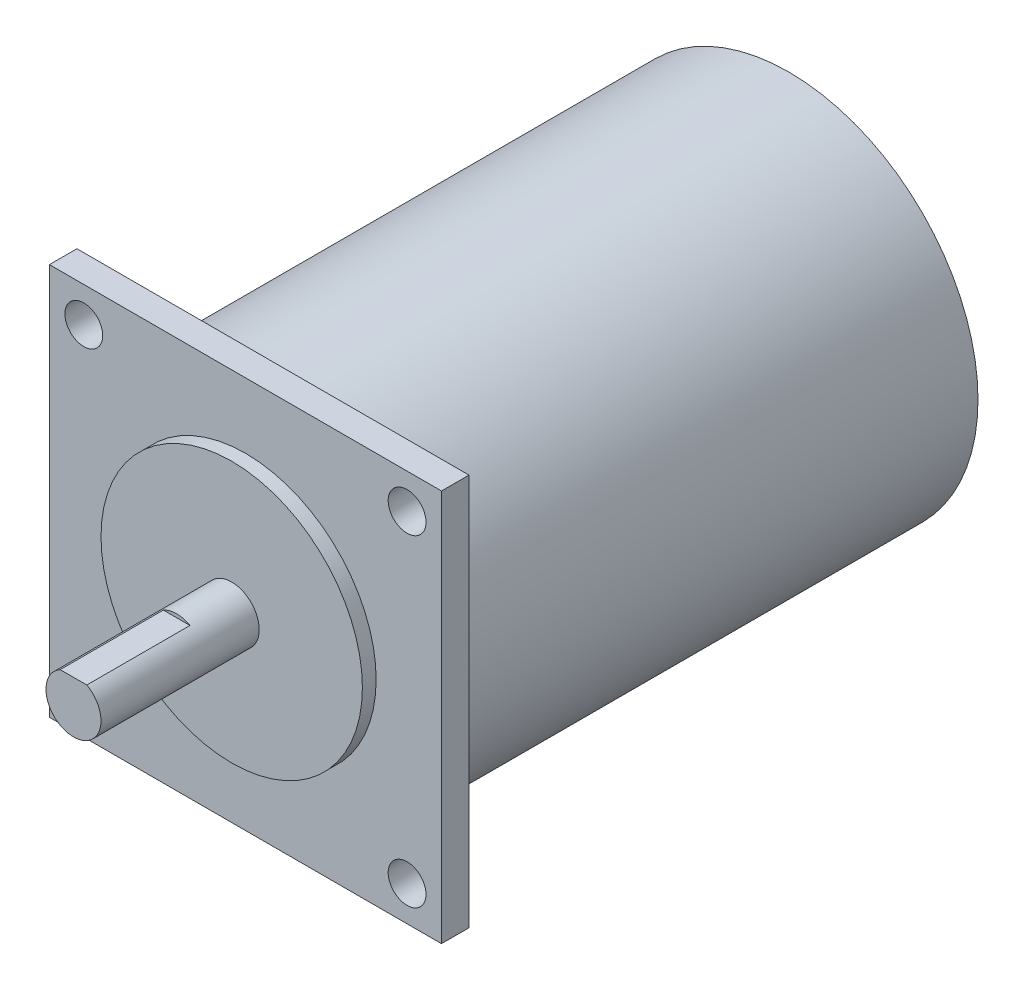
from build123d import *

# Parameters (mm, degrees)
SKETCH_1_W          = 57
SKETCH_1_H          = 57
SKETCH_1_R          = 2.75
EXTRUDE_1_DEPTH     = 4
SKETCH_2_R          = 27.5
EXTRUDE_2_DEPTH     = 75
SKETCH_3_R          = 19
EXTRUDE_3_DEPTH     = 2
SKETCH_4_R          = 4
EXTRUDE_4_DEPTH     = 23
SKETCH_5_W          = 15
SKETCH_5_H          = 0.5
CUT_EXTRUDE_1_DEPTH = 23


with BuildPart() as part:
    # 草图1 → 凸台-拉伸1 (new body)
    with BuildSketch(Plane.XY):
        with Locations((-6.18683274, 8.316725979)):
            Rectangle(SKETCH_1_W, SKETCH_1_H)
        with Locations((-29.68683274, 31.745551601)):
            Circle(SKETCH_1_R, mode=Mode.SUBTRACT)
        with Locations(Location((17.31316726, 31.745551601, 0), (0, 0, 180))):
            Circle(SKETCH_1_R, mode=Mode.SUBTRACT)
        with Locations((17.31316726, -15.112099644)):
            Circle(SKETCH_1_R, mode=Mode.SUBTRACT)
        with Locations(Location((-29.68683274, -15.112099644, 0), (0, 0, 180))):
            Circle(SKETCH_1_R, mode=Mode.SUBTRACT)
    extrude(amount=EXTRUDE_1_DEPTH)

    # 草图2 → 凸台-拉伸2 (add)
    with BuildSketch(Plane(origin=(0, 0, 0), x_dir=(-1, 0, 0), z_dir=(0, 0, -1))):
        with Locations(Location((6.18683274, 8.316725979, 0), (0, 0, 180))):
            Circle(SKETCH_2_R)
    extrude(amount=EXTRUDE_2_DEPTH)

    # 草图3 → 凸台-拉伸3 (add)
    with BuildSketch(Plane.XY.offset(4)):
        with Locations((-6.18683274, 8.316725979)):
            Circle(SKETCH_3_R)
    extrude(amount=EXTRUDE_3_DEPTH)

    # 草图4 → 凸台-拉伸4 (add)
    with BuildSketch(Plane.XY.offset(6)):
        with Locations((-6.18683274, 8.10325499)):
            Circle(SKETCH_4_R)
    extrude(amount=EXTRUDE_4_DEPTH)

    # 草图5 → 切除-拉伸1 (cut)
    with BuildSketch(Plane(origin=(-2.18683274, 0, 0), x_dir=(0, 0, -1), z_dir=(1, 0, 0))):
        with Locations((-21.5, 11.85325499)):
            Rectangle(SKETCH_5_W, SKETCH_5_H)
    extrude(amount=-CUT_EXTRUDE_1_DEPTH, mode=Mode.SUBTRACT)


solid = part.part
